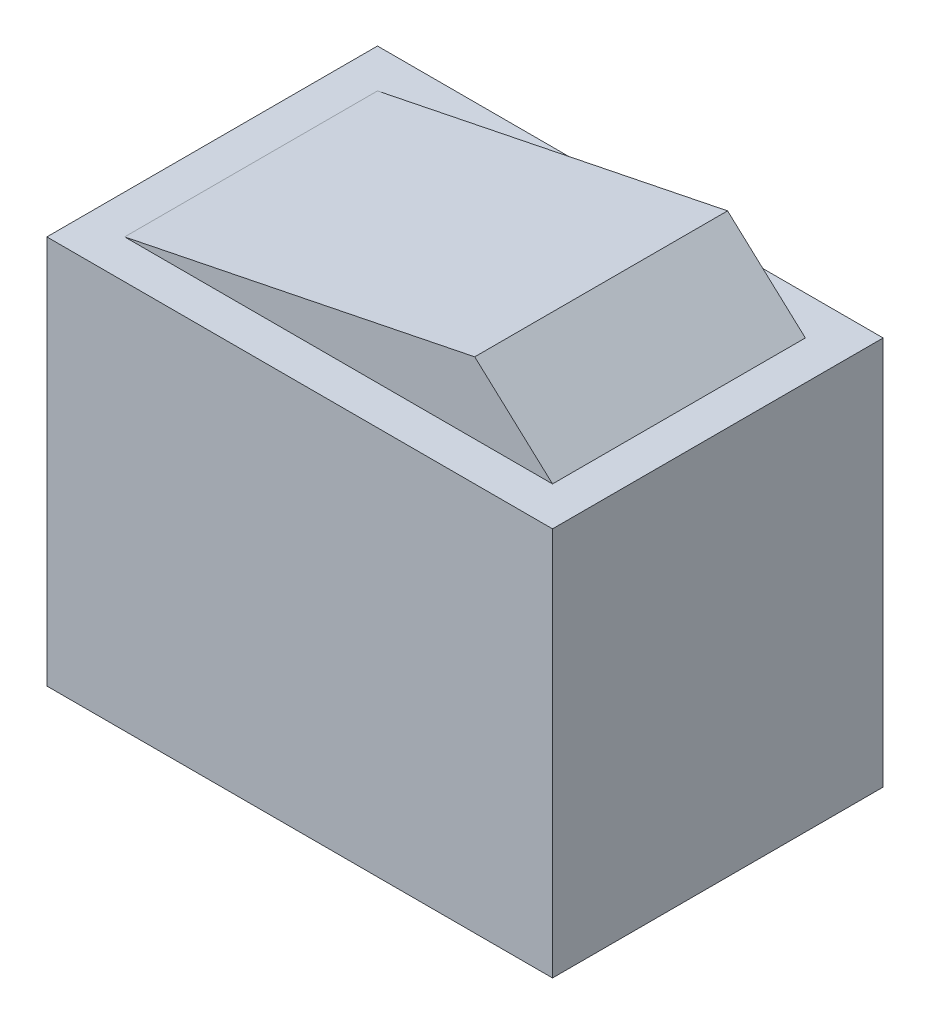
from build123d import *

# Parameters (mm, degrees)
SKETCH1_W           = 13
SKETCH1_H           = 8.5
BOSS_EXTRUDE1_DEPTH = 10
BOSS_EXTRUDE2_DEPTH = 6.5


with BuildPart() as part:
    # Sketch1 → Boss-Extrude1 (new body)
    with BuildSketch(Plane(origin=(0, 0, 0), x_dir=(1, 0, 0), z_dir=(0, 1, 0))):
        Rectangle(SKETCH1_W, SKETCH1_H)
    extrude(amount=BOSS_EXTRUDE1_DEPTH)

    # Sketch2 → Boss-Extrude2 (add)
    with BuildSketch(Plane.XY.offset(3.25)):
        Polygon((-5.5, 10), (5.5, 10), (3.5, 11.829740684), align=None)
    extrude(amount=-BOSS_EXTRUDE2_DEPTH)


solid = part.part
